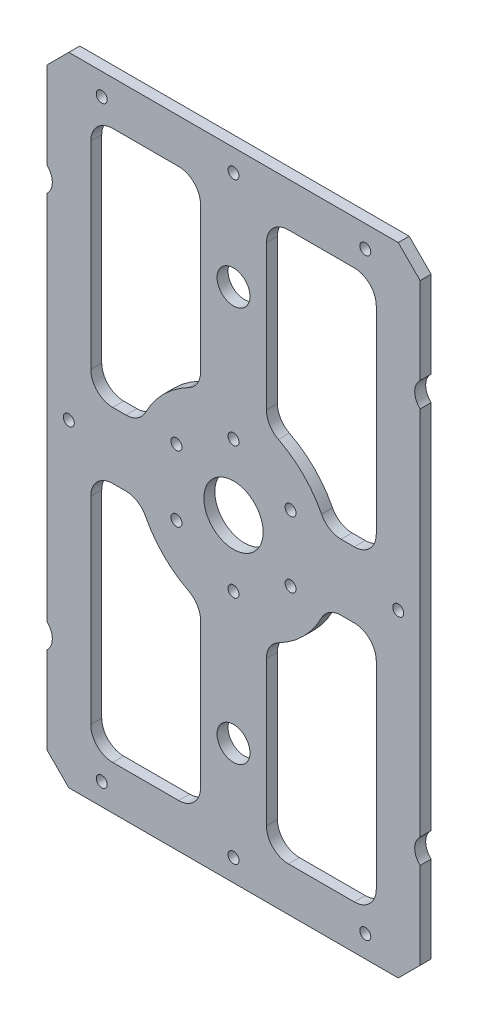
from build123d import *

# Parameters (mm, degrees)
SKETCH_1_W          = 170
SKETCH_1_H          = 290
EXTRUDE_1_DEPTH     = 5
SKETCH_2_R          = 13.5
CUT_EXTRUDE_1_DEPTH = 169.151717208
SKETCH_3_R          = 2.5
CUT_EXTRUDE_2_DEPTH = 169.151717208
CHAMFER_1_SIZE      = 10
SKETCH_4_R          = 7.5
SKETCH_4_R_2        = 2.5
CUT_EXTRUDE_3_DEPTH = 169.151717208
CUT_EXTRUDE_4_DEPTH = 169.151717208
FILLET_1_R          = 10


with BuildPart() as part:
    # ｽｹｯﾁ1 → ﾎﾞｽ - 押し出し1 (new body)
    with BuildSketch(Plane.XY):
        Rectangle(SKETCH_1_W, SKETCH_1_H)
    extrude(amount=EXTRUDE_1_DEPTH)

    # ｽｹｯﾁ2 → ｶｯﾄ - 押し出し1 (cut, through all)
    with BuildSketch(Plane.XY.offset(5)):
        Circle(SKETCH_2_R)
    extrude(amount=-CUT_EXTRUDE_1_DEPTH, mode=Mode.SUBTRACT)

    # ｽｹｯﾁ3 → ｶｯﾄ - 押し出し2 (cut, through all)
    with BuildSketch(Plane.XY.offset(5)):
        with Locations((-75, 0)):
            Circle(SKETCH_3_R)
        with Locations((0, 135)):
            Circle(SKETCH_3_R)
        with Locations((75, 0)):
            Circle(SKETCH_3_R)
        with Locations((0, -135)):
            Circle(SKETCH_3_R)
        with Locations((-60, 135)):
            Circle(SKETCH_3_R)
        with Locations((60, 135)):
            Circle(SKETCH_3_R)
        with Locations((60, -135)):
            Circle(SKETCH_3_R)
        with Locations((-60, -135)):
            Circle(SKETCH_3_R)
    extrude(amount=-CUT_EXTRUDE_2_DEPTH, mode=Mode.SUBTRACT)

    # 面取り1
    chamfer_1_edges = [part.edges().sort_by_distance(p)[0] for p in [
        (85, -145, 2.5),
        (-85, -145, 2.5),
        (-85, 145, 2.5),
        (85, 145, 2.5),
    ]]
    chamfer(chamfer_1_edges, length=CHAMFER_1_SIZE)

    # ｽｹｯﾁ4 → ｶｯﾄ - 押し出し3 (cut, through all)
    with BuildSketch(Plane.XY.offset(5)):
        with Locations((90, 90)):
            Circle(SKETCH_4_R)
        with Locations((0, 90)):
            Circle(SKETCH_4_R)
        with Locations((-90, 90)):
            Circle(SKETCH_4_R)
        with Locations((-90, -90)):
            Circle(SKETCH_4_R)
        with Locations(Location((0, -90, 0), (0, 0, 180))):
            Circle(SKETCH_4_R)
        with Locations((90, -90)):
            Circle(SKETCH_4_R)
        with Locations((0, -30)):
            Circle(SKETCH_4_R_2)
        with Locations((-25.980762114, -15)):
            Circle(SKETCH_4_R_2)
        with Locations((-25.980762114, 15)):
            Circle(SKETCH_4_R_2)
        with Locations((0, 30)):
            Circle(SKETCH_4_R_2)
        with Locations((25.980762114, 15)):
            Circle(SKETCH_4_R_2)
        with Locations((25.980762114, -15)):
            Circle(SKETCH_4_R_2)
    extrude(amount=-CUT_EXTRUDE_3_DEPTH, mode=Mode.SUBTRACT)

    # ｽｹｯﾁ5 → ｶｯﾄ - 押し出し4 (cut, through all)
    with BuildSketch(Plane.XY.offset(5)):
        with BuildLine():
            Line((-65, 125), (-65, 15))
            Line((-65, 15), (-42.426406871, 15))
            ThreePointArc((-42.426406871, 15), (-31.819805153, 31.819805153), (-15, 42.426406871))
            Line((-15, 42.426406871), (-15, 125))
            Line((-15, 125), (-65, 125))
        make_face()
        with BuildLine():
            Line((15, 42.426406871), (15, 125))
            Line((15, 125), (65, 125))
            Line((65, 125), (65, 15))
            Line((65, 15), (42.426406871, 15))
            ThreePointArc((42.426406871, 15), (31.819805153, 31.819805153), (15, 42.426406871))
        make_face()
        with BuildLine():
            Line((-15, -42.426406871), (-15, -125))
            Line((-15, -125), (-65, -125))
            Line((-65, -125), (-65, -15))
            Line((-65, -15), (-42.426406871, -15))
            ThreePointArc((-42.426406871, -15), (-31.819805153, -31.819805153), (-15, -42.426406871))
        make_face()
        with BuildLine():
            Line((15, -42.426406871), (15, -125))
            Line((15, -125), (65, -125))
            Line((65, -125), (65, -15))
            Line((65, -15), (42.426406871, -15))
            ThreePointArc((42.426406871, -15), (31.819805153, -31.819805153), (15, -42.426406871))
        make_face()
    extrude(amount=-CUT_EXTRUDE_4_DEPTH, mode=Mode.SUBTRACT)

    # ﾌｨﾚｯﾄ1
    fillet_1_edges = [part.edges().sort_by_distance(p)[0] for p in [
        (42.426406871, 15, 2.5),
        (15, 42.426406871, 2.5),
        (15, 125, 2.5),
        (65, 125, 2.5),
        (65, 15, 2.5),
        (-42.426406871, -15, 2.5),
        (-15, -42.426406871, 2.5),
        (-15, -125, 2.5),
        (-65, -125, 2.5),
        (-65, -15, 2.5),
        (15, -42.426406871, 2.5),
        (42.426406871, -15, 2.5),
        (65, -15, 2.5),
        (65, -125, 2.5),
        (15, -125, 2.5),
        (-65, 125, 2.5),
        (-15, 125, 2.5),
        (-15, 42.426406871, 2.5),
        (-42.426406871, 15, 2.5),
        (-65, 15, 2.5),
    ]]
    fillet(fillet_1_edges, radius=FILLET_1_R)


solid = part.part
